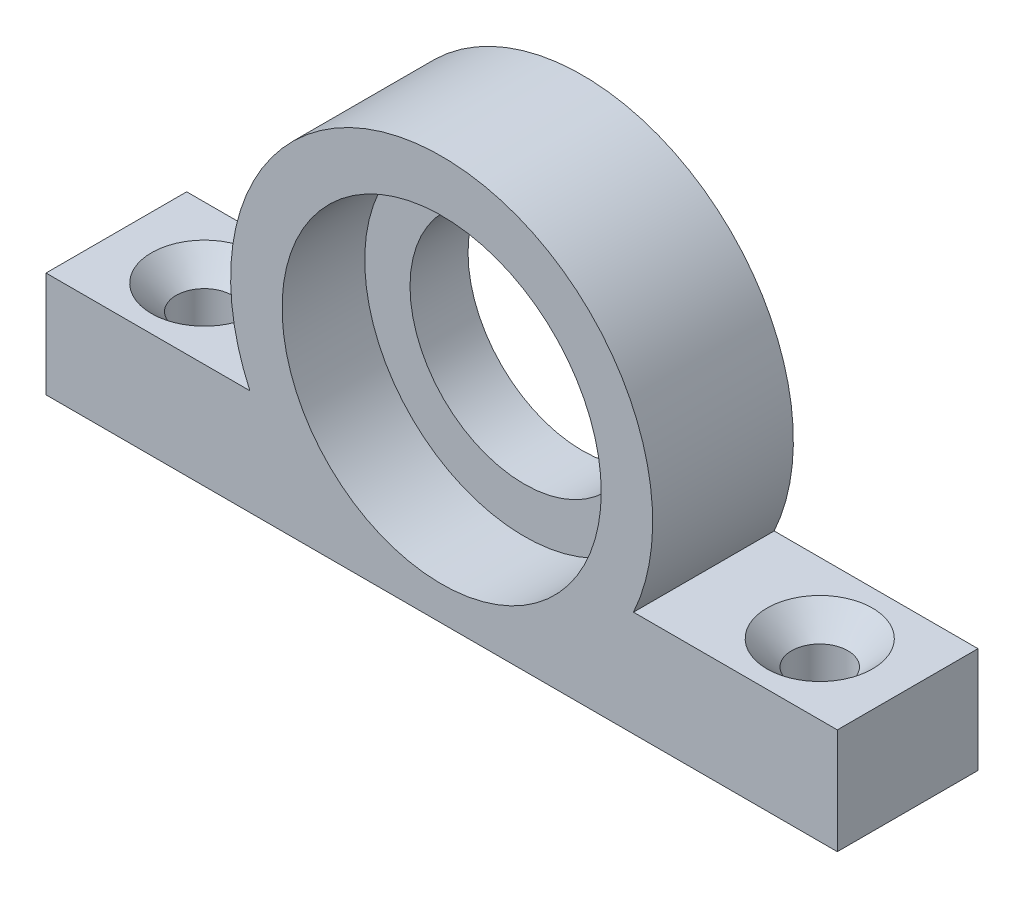
from build123d import *

# Parameters (mm, degrees)
BOSS_EXTRUDE1_DEPTH = 8
SKETCH2_R           = 9.075
CUT_EXTRUDE1_DEPTH  = 4.7
HOLE1_D             = 3.2
HOLE1_CSINK_D       = 6
HOLE1_CSINK_ANGLE   = 90


with BuildPart() as part:
    # Sketch1 → Boss-Extrude1 (new body)
    with BuildSketch(Plane.XY):
        with BuildLine():
            Line((-27.295831523, 0), (-17.704168477, 0))
            ThreePointArc((-17.704168477, 0), (-14.094158417, 2.436015689), (-11.591287885, 6))
            Line((-11.591287885, 6), (-18.346688069, 6))
            ThreePointArc((-18.346688069, 6), (-22.5, 4.5), (-26.653311931, 6))
            Line((-26.653311931, 6), (-33.408712115, 6))
            ThreePointArc((-33.408712115, 6), (-30.905841583, 2.436015689), (-27.295831523, 0))
        make_face()
        with BuildLine():
            Line((-45, 0), (-27.295831523, 0))
            ThreePointArc((-27.295831523, 0), (-30.905841583, 2.436015689), (-33.408712115, 6))
            Line((-33.408712115, 6), (-36, 6))
            Line((-36, 6), (-45, 6))
            Line((-45, 6), (-45, 0))
        make_face()
        with BuildLine():
            Line((-18.346688069, 6), (-11.591287885, 6))
            ThreePointArc((-11.591287885, 6), (-10.82107856, 8.242683552), (-10.506902886, 10.593033646))
            add(Edge.make_bspline(
                [(-10.506902886, 10.593033646), (-10.587978043, 10.993773754), (-10.5, 11)],
                knots=[0.717855618, 0.717855618, 0.717855618, 1, 1, 1], degree=2))
            ThreePointArc((-10.5, 11), (-22.5, 23), (-34.5, 11))
            add(Edge.make_bspline(
                [(-34.493097114, 10.593033646), (-34.412021957, 10.993773754), (-34.5, 11)],
                knots=[0.717855618, 0.717855618, 0.717855618, 1, 1, 1], degree=2))
            ThreePointArc((-34.493097114, 10.593033646), (-34.17892144, 8.242683552), (-33.408712115, 6))
            Line((-33.408712115, 6), (-26.653311931, 6))
            ThreePointArc((-26.653311931, 6), (-25.261654617, 16.884153616), (-16, 11))
            ThreePointArc((-16, 11), (-16.615846384, 8.238345383), (-18.346688069, 6))
        make_face()
        with BuildLine():
            Line((-17.704168477, 0), (0, 0))
            Line((0, 0), (0, 6))
            Line((0, 6), (-9, 6))
            Line((-9, 6), (-11.591287885, 6))
            ThreePointArc((-11.591287885, 6), (-14.094158417, 2.436015689), (-17.704168477, 0))
        make_face()
        with BuildLine():
            ThreePointArc((-34.5, 11), (-34.498274154, 10.796487554), (-34.493097114, 10.593033646))
            add(Edge.make_bspline(
                [(-34.493097114, 10.593033646), (-34.412021957, 10.993773754), (-34.5, 11)],
                knots=[0.717855618, 0.717855618, 0.717855618, 1, 1, 1], degree=2))
        make_face()
        with BuildLine():
            add(Edge.make_bspline(
                [(-10.506902886, 10.593033646), (-10.587978043, 10.993773754), (-10.5, 11)],
                knots=[0.717855618, 0.717855618, 0.717855618, 1, 1, 1], degree=2))
            ThreePointArc((-10.506902886, 10.593033646), (-10.501725846, 10.796487554), (-10.5, 11))
        make_face()
    extrude(amount=BOSS_EXTRUDE1_DEPTH)

    # Sketch2 → Cut-Extrude1 (cut)
    with BuildSketch(Plane.XY.offset(8)):
        with Locations((-22.5, 11)):
            Circle(SKETCH2_R)
    extrude(amount=-CUT_EXTRUDE1_DEPTH, mode=Mode.SUBTRACT)

    # Hole1 (through all)
    with Locations(Plane(origin=(-40, 6, 4), x_dir=(1, 0, 0), z_dir=(0, 1, 0))):
        with Locations((0, 0), (35, 0)):
            CounterSinkHole(HOLE1_D / 2, HOLE1_CSINK_D / 2, counter_sink_angle=HOLE1_CSINK_ANGLE)


solid = part.part
